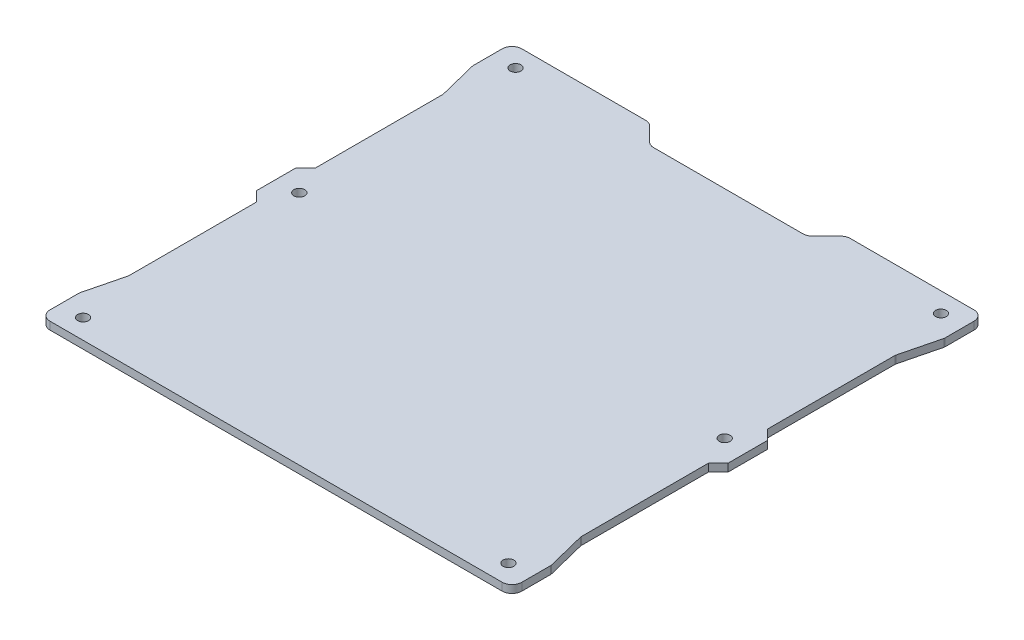
from build123d import *

# Parameters (mm, degrees)
BOSS_EXTRUDE1_DEPTH = 2.5
SKETCH2_R           = 3.5
BOSS_EXTRUDE2_DEPTH = 2.5
FILLET1_R           = 6.35
FILLET2_R           = 6.35
FILLET3_R           = 3
BOSS_EXTRUDE3_DEPTH = 5
CUT_EXTRUDE1_REACH  = 217.584
SKETCH3_4_R         = 3.5


with BuildPart() as part:
    # Sketch1 → Boss-Extrude1 (new, symmetric)
    with BuildSketch(Plane(origin=(0, 0, 0), x_dir=(1, 0, 0), z_dir=(0, 1, 0))):
        Polygon((63.5, 152.4), (127, 152.4), (127, -152.4), (-127, -152.4), (-127, 152.4), (-63.5, 152.4), (-50.8, 139.7), (50.8, 139.7), align=None)
    extrude(amount=BOSS_EXTRUDE1_DEPTH, both=True)

    # Sketch2 → Boss-Extrude2 (add, symmetric)
    # profile 1 of 2: a face of its own
    with BuildSketch(Plane(origin=(0, 0, 0), x_dir=(1, 0, 0), z_dir=(0, 1, 0))):
        Polygon((127, 152.4), (152.4, 152.4), (152.4, 127), (146.05, 101.6), (146.05, -101.6), (152.4, -127), (152.4, -152.4), (127, -152.4), align=None)
        with Locations(Location((137.4, 139.7, 0), (0, 0, 270))):
            Circle(SKETCH2_R, mode=Mode.SUBTRACT)
        with Locations(Location((137.4, -139.7, 0), (0, 0, 270))):
            Circle(SKETCH2_R, mode=Mode.SUBTRACT)
    # profile 2 of 2: a face of its own
    with BuildSketch(Plane(origin=(0, 0, 0), x_dir=(1, 0, 0), z_dir=(0, 1, 0))):
        Polygon((-127, 152.4), (-152.4, 152.4), (-152.4, 127), (-146.05, 101.6), (-146.05, -101.6), (-152.4, -127), (-152.4, -152.4), (-127, -152.4), align=None)
        with Locations(Location((-137.4, -139.7, 0), (0, 0, 90))):
            Circle(SKETCH2_R, mode=Mode.SUBTRACT)
        with Locations(Location((-137.4, 139.7, 0), (0, 0, 90))):
            Circle(SKETCH2_R, mode=Mode.SUBTRACT)
    extrude(amount=BOSS_EXTRUDE2_DEPTH, both=True)

    # Fillet1
    fillet1_edges = [part.edges().sort_by_distance(p)[0] for p in [
        (152.4, 0, 152.4),
        (152.4, 0, -152.4),
        (-152.4, 0, -152.4),
        (-152.4, 0, 152.4),
    ]]
    fillet(fillet1_edges, radius=FILLET1_R)

    # Fillet2
    fillet2_edges = [part.edges().sort_by_distance(p)[0] for p in [
        (-63.5, 0, -152.4),
        (-50.8, 0, -139.7),
        (50.8, 0, -139.7),
        (63.5, 0, -152.4),
    ]]
    fillet(fillet2_edges, radius=FILLET2_R)

    # Fillet3
    fillet3_edges = [part.edges().sort_by_distance(p)[0] for p in [
        (152.4, 0, 127),
        (146.05, 0, 101.6),
        (146.05, 0, -101.6),
        (152.4, 0, -127),
        (-152.4, 0, -127),
        (-146.05, 0, -101.6),
        (-146.05, 0, 101.6),
        (-152.4, 0, 127),
    ]]
    fillet(fillet3_edges, radius=FILLET3_R)

    # Sketch3 → Boss-Extrude3 (add)
    with BuildSketch(Plane(origin=(0, 2.5, 0), x_dir=(1, 0, 0), z_dir=(0, 1, 0))):
        Polygon((-146.05, 19.05), (-152.4, 12.7), (-152.4, -12.7), (-146.05, -19.05), align=None)
        Polygon((152.4, -12.7), (152.4, 12.7), (146.05, 19.05), (146.05, -19.05), align=None)
    extrude(amount=-BOSS_EXTRUDE3_DEPTH)

    # Sketch3<4> → Cut-Extrude1 (cut, up to next)
    with BuildSketch(Plane(origin=(0, 2.5, 0), x_dir=(1, 0, 0), z_dir=(0, 1, 0)), mode=Mode.PRIVATE) as cut_extrude1_sk1:
        with Locations(Location((-137.4, 0, 0), (0, 0, 270))):
            Circle(SKETCH3_4_R)
    cut_extrude1_tool1 = extrude(cut_extrude1_sk1.sketch, amount=-CUT_EXTRUDE1_REACH, mode=Mode.PRIVATE) & part.part
    # Sketch3<4> → Cut-Extrude1 (cut, up to next)
    with BuildSketch(Plane(origin=(0, 2.5, 0), x_dir=(1, 0, 0), z_dir=(0, 1, 0)), mode=Mode.PRIVATE) as cut_extrude1_sk2:
        with Locations(Location((137.4, 0, 0), (0, 0, 270))):
            Circle(SKETCH3_4_R)
    cut_extrude1_tool2 = extrude(cut_extrude1_sk2.sketch, amount=-CUT_EXTRUDE1_REACH, mode=Mode.PRIVATE) & part.part
    add(cut_extrude1_tool1.solids().sort_by_distance((-137.4, 2.5, 0))[0], mode=Mode.SUBTRACT)
    add(cut_extrude1_tool2.solids().sort_by_distance((137.4, 2.5, 0))[0], mode=Mode.SUBTRACT)


solid = part.part
